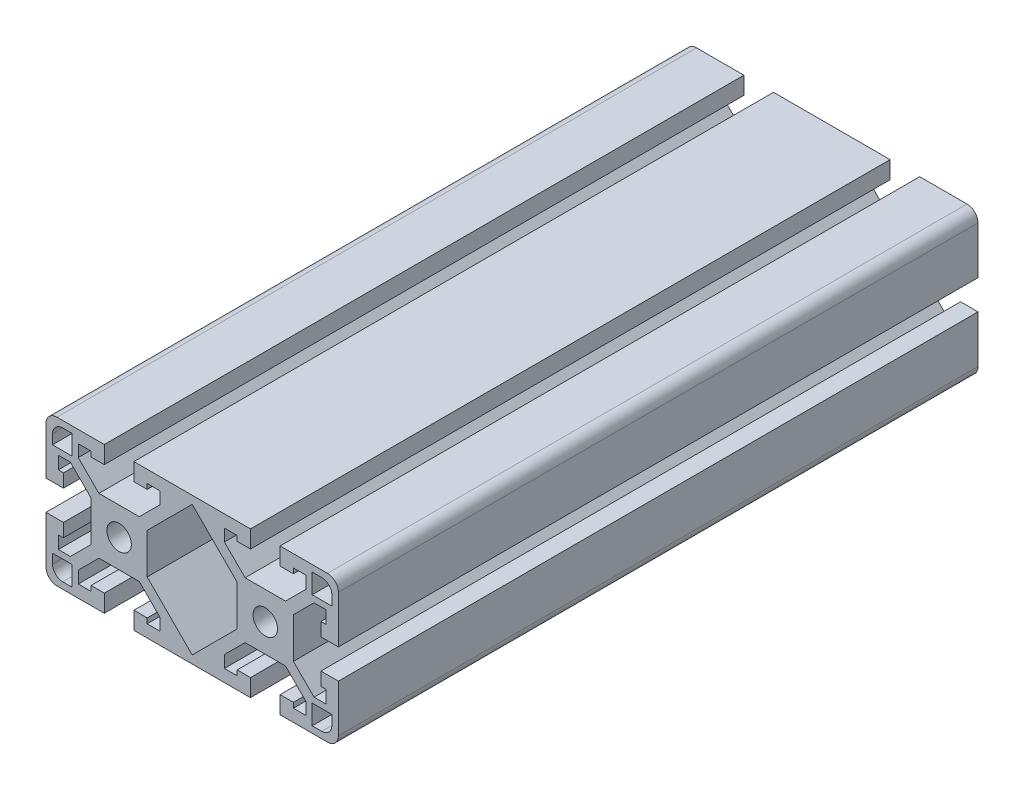
from build123d import *

# Parameters (mm, degrees)
SKETCH2_R                            = 3.35
F_40_SERIES_TS40_80LM_650037_1_DEPTH = 175
M8X1_25_TAPPED_HOLE1_D               = 6.8
M8X1_25_TAPPED_HOLE1_DEPTH           = 30
M8X1_25_TAPPED_HOLE1_TIP             = 2.042926105


with BuildPart() as part:
    # Sketch2 → 40 series TS40-80LM-650037(1) (new body)
    with BuildSketch(Plane(origin=(0, 0, 0), x_dir=(0, 1, 0), z_dir=(0, 0, 1))):
        with BuildLine():
            Line((0, -27.681), (-5.525738531, -27.681))
            Line((-5.525738531, -27.681), (-11.176, -33.331261469))
            Line((-11.176, -33.331261469), (-11.176, -36.6218))
            Line((-11.176, -36.6218), (-7.6835, -36.6218))
            Line((-7.6835, -36.6218), (-7.6835, -35.2248))
            Line((-7.6835, -35.2248), (-4.0488, -35.2248))
            Line((-4.0488, -35.2248), (-4.0488, -40))
            Line((-4.0488, -40), (-17, -40))
            ThreePointArc((-17, -40), (-19.121320344, -39.121320344), (-20, -37))
            Line((-20, -37), (-20, -24.0488))
            Line((-20, -24.0488), (-15.2248, -24.0488))
            Line((-15.2248, -24.0488), (-15.2248, -27.6835))
            Line((-15.2248, -27.6835), (-16.6218, -27.6835))
            Line((-16.6218, -27.6835), (-16.6218, -31.176))
            Line((-16.6218, -31.176), (-13.331261469, -31.176))
            Line((-13.331261469, -31.176), (-7.681, -25.525738531))
            Line((-7.681, -25.525738531), (-7.681, -20))
            Line((-7.681, -20), (-7.681, -14.474261469))
            Line((-7.681, -14.474261469), (-13.331261469, -8.824))
            Line((-13.331261469, -8.824), (-16.6218, -8.824))
            Line((-16.6218, -8.824), (-16.6218, -12.3165))
            Line((-16.6218, -12.3165), (-15.2248, -12.3165))
            Line((-15.2248, -12.3165), (-15.2248, -15.9512))
            Line((-15.2248, -15.9512), (-20, -15.9512))
            Line((-20, -15.9512), (-20, 15.9512))
            Line((-20, 15.9512), (-15.2248, 15.9512))
            Line((-15.2248, 15.9512), (-15.2248, 12.3165))
            Line((-15.2248, 12.3165), (-16.6218, 12.3165))
            Line((-16.6218, 12.3165), (-16.6218, 8.824))
            Line((-16.6218, 8.824), (-13.331261469, 8.824))
            Line((-13.331261469, 8.824), (-7.681, 14.474261469))
            Line((-7.681, 14.474261469), (-7.681, 25.525738531))
            Line((-7.681, 25.525738531), (-13.331261469, 31.176))
            Line((-13.331261469, 31.176), (-16.6218, 31.176))
            Line((-16.6218, 31.176), (-16.6218, 27.6835))
            Line((-16.6218, 27.6835), (-15.2248, 27.6835))
            Line((-15.2248, 27.6835), (-15.2248, 24.0488))
            Line((-15.2248, 24.0488), (-20, 24.0488))
            Line((-20, 24.0488), (-20, 37))
            ThreePointArc((-20, 37), (-19.121320344, 39.121320344), (-17, 40))
            Line((-17, 40), (-4.0488, 40))
            Line((-4.0488, 40), (-4.0488, 35.2248))
            Line((-4.0488, 35.2248), (-7.6835, 35.2248))
            Line((-7.6835, 35.2248), (-7.6835, 36.6218))
            Line((-7.6835, 36.6218), (-11.176, 36.6218))
            Line((-11.176, 36.6218), (-11.176, 33.331261469))
            Line((-11.176, 33.331261469), (-5.525738531, 27.681))
            Line((-5.525738531, 27.681), (0, 27.681))
            Line((0, 27.681), (5.525738531, 27.681))
            Line((5.525738531, 27.681), (11.176, 33.331261469))
            Line((11.176, 33.331261469), (11.176, 36.6218))
            Line((11.176, 36.6218), (7.6835, 36.6218))
            Line((7.6835, 36.6218), (7.6835, 35.2248))
            Line((7.6835, 35.2248), (4.0488, 35.2248))
            Line((4.0488, 35.2248), (4.0488, 40))
            Line((4.0488, 40), (17, 40))
            ThreePointArc((17, 40), (19.121320344, 39.121320344), (20, 37))
            Line((20, 37), (20, 24.0488))
            Line((20, 24.0488), (15.2248, 24.0488))
            Line((15.2248, 24.0488), (15.2248, 27.6835))
            Line((15.2248, 27.6835), (16.6218, 27.6835))
            Line((16.6218, 27.6835), (16.6218, 31.176))
            Line((16.6218, 31.176), (13.331261469, 31.176))
            Line((13.331261469, 31.176), (7.681, 25.525738531))
            Line((7.681, 25.525738531), (7.681, 20))
            Line((7.681, 20), (7.681, 14.474261469))
            Line((7.681, 14.474261469), (13.331261469, 8.824))
            Line((13.331261469, 8.824), (16.6218, 8.824))
            Line((16.6218, 8.824), (16.6218, 12.3165))
            Line((16.6218, 12.3165), (15.2248, 12.3165))
            Line((15.2248, 12.3165), (15.2248, 15.9512))
            Line((15.2248, 15.9512), (20, 15.9512))
            Line((20, 15.9512), (20, -15.9512))
            Line((20, -15.9512), (15.2248, -15.9512))
            Line((15.2248, -15.9512), (15.2248, -12.3165))
            Line((15.2248, -12.3165), (16.6218, -12.3165))
            Line((16.6218, -12.3165), (16.6218, -8.824))
            Line((16.6218, -8.824), (13.331261469, -8.824))
            Line((13.331261469, -8.824), (7.681, -14.474261469))
            Line((7.681, -14.474261469), (7.681, -20))
            Line((7.681, -20), (7.681, -25.525738531))
            Line((7.681, -25.525738531), (13.331261469, -31.176))
            Line((13.331261469, -31.176), (16.6218, -31.176))
            Line((16.6218, -31.176), (16.6218, -27.6835))
            Line((16.6218, -27.6835), (15.2248, -27.6835))
            Line((15.2248, -27.6835), (15.2248, -24.0488))
            Line((15.2248, -24.0488), (20, -24.0488))
            Line((20, -24.0488), (20, -37))
            ThreePointArc((20, -37), (19.121320344, -39.121320344), (17, -40))
            Line((17, -40), (4.0488, -40))
            Line((4.0488, -40), (4.0488, -35.2248))
            Line((4.0488, -35.2248), (7.6835, -35.2248))
            Line((7.6835, -35.2248), (7.6835, -36.6218))
            Line((7.6835, -36.6218), (11.176, -36.6218))
            Line((11.176, -36.6218), (11.176, -33.331261469))
            Line((11.176, -33.331261469), (5.525738531, -27.681))
            Line((5.525738531, -27.681), (0, -27.681))
        make_face()
        with Locations((0, -20)):
            Circle(SKETCH2_R, mode=Mode.SUBTRACT)
        with Locations((0, 20)):
            Circle(SKETCH2_R, mode=Mode.SUBTRACT)
        Polygon((-5.525738531, 12.319), (-17.844738531, 0), (-5.525738531, -12.319), (0, -12.319), (5.525738531, -12.319), (17.844738531, 0), (5.525738531, 12.319), (0, 12.319), align=None, mode=Mode.SUBTRACT)
        with BuildLine():
            Line((12.8372, 38.222), (12.8372, 32.8372))
            Line((12.8372, 32.8372), (18.222, 32.8372))
            Line((18.222, 32.8372), (18.222, 35.428))
            ThreePointArc((18.222, 35.428), (17.403656347, 37.403656347), (15.428, 38.222))
            Line((15.428, 38.222), (12.8372, 38.222))
        make_face(mode=Mode.SUBTRACT)
        with BuildLine():
            Line((12.8372, -32.8372), (18.222, -32.8372))
            Line((18.222, -32.8372), (18.222, -35.428))
            ThreePointArc((18.222, -35.428), (17.403656347, -37.403656347), (15.428, -38.222))
            Line((15.428, -38.222), (12.8372, -38.222))
            Line((12.8372, -38.222), (12.8372, -32.8372))
        make_face(mode=Mode.SUBTRACT)
        with BuildLine():
            Line((-12.8372, -38.222), (-12.8372, -32.8372))
            Line((-12.8372, -32.8372), (-18.222, -32.8372))
            Line((-18.222, -32.8372), (-18.222, -35.428))
            ThreePointArc((-18.222, -35.428), (-17.403656347, -37.403656347), (-15.428, -38.222))
            Line((-15.428, -38.222), (-12.8372, -38.222))
        make_face(mode=Mode.SUBTRACT)
        with BuildLine():
            Line((-18.222, 35.428), (-18.222, 32.8372))
            Line((-18.222, 32.8372), (-12.8372, 32.8372))
            Line((-12.8372, 32.8372), (-12.8372, 38.222))
            Line((-12.8372, 38.222), (-15.428, 38.222))
            ThreePointArc((-15.428, 38.222), (-17.403656347, 37.403656347), (-18.222, 35.428))
        make_face(mode=Mode.SUBTRACT)
    extrude(amount=F_40_SERIES_TS40_80LM_650037_1_DEPTH)

    # M8x1.25 Tapped Hole1
    with Locations(Plane(origin=(0, 0, 0), x_dir=(-1, 0, 0), z_dir=(0, 0, -1))):
        with Locations((-20, 0), (20, 0)):
            Hole(M8X1_25_TAPPED_HOLE1_D / 2, depth=M8X1_25_TAPPED_HOLE1_DEPTH)
            with Locations((0, 0, -(M8X1_25_TAPPED_HOLE1_DEPTH + M8X1_25_TAPPED_HOLE1_TIP / 2))):  # 118° drill point
                Cone(0, M8X1_25_TAPPED_HOLE1_D / 2, M8X1_25_TAPPED_HOLE1_TIP, mode=Mode.SUBTRACT)


solid = part.part
